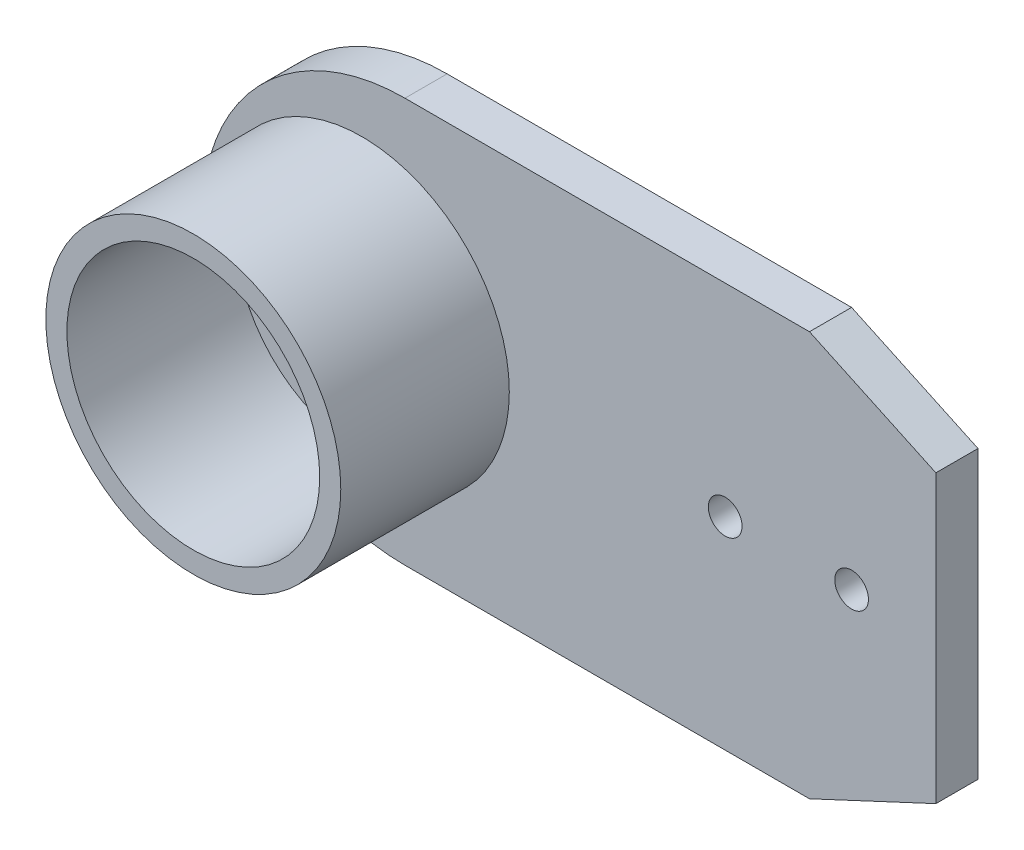
from build123d import *

# Parameters (mm, degrees)
BOSS_EXTRUDE2_DEPTH = 5
SKETCH2_R           = 2
CUT_EXTRUDE1_DEPTH  = 50.932454376
SKETCH3_R           = 5
CUT_EXTRUDE2_DEPTH  = 5
CUT_EXTRUDE5_DEPTH  = 50.932454376
SKETCH10_R          = 17.5
BOSS_EXTRUDE5_DEPTH = 20
SKETCH11_R          = 15
CUT_EXTRUDE6_DEPTH  = 20


with BuildPart() as part:
    # Sketch1 → Boss-Extrude2 (new body)
    with BuildSketch(Plane.XY):
        with BuildLine():
            Line((-19.5, 24), (43.5, 24))
            Line((43.5, 24), (43.5, -24))
            Line((43.5, -24), (-19.5, -24))
            ThreePointArc((-19.5, -24), (-43.5, 0), (-19.5, 24))
        make_face()
    extrude(amount=BOSS_EXTRUDE2_DEPTH)

    # Sketch2 → Cut-Extrude1 (cut, through all)
    with BuildSketch(Plane.XY.offset(5)):
        with Locations((33.5, 0)):
            Circle(SKETCH2_R)
        with Locations((18.5, 0)):
            Circle(SKETCH2_R)
    extrude(amount=-CUT_EXTRUDE1_DEPTH, mode=Mode.SUBTRACT)

    # Sketch3 → Cut-Extrude2 (cut)
    with BuildSketch(Plane.XY.offset(5)):
        with Locations((-24.61729874, 0)):
            Circle(SKETCH3_R)
    extrude(amount=-CUT_EXTRUDE2_DEPTH, mode=Mode.SUBTRACT)

    # Sketch9 → Cut-Extrude5 (cut, through all)
    with BuildSketch(Plane.XY.offset(5)):
        Polygon((28.5, 24), (43.5, 17), (43.5, 24), align=None)
        Polygon((43.5, -17), (28.5, -24), (43.5, -24), align=None)
    extrude(amount=-CUT_EXTRUDE5_DEPTH, mode=Mode.SUBTRACT)

    # Sketch10 → Boss-Extrude5 (add)
    with BuildSketch(Plane.XY.offset(5)):
        with Locations((-24.61729874, 0)):
            Circle(SKETCH10_R)
    extrude(amount=BOSS_EXTRUDE5_DEPTH)

    # Sketch11 → Cut-Extrude6 (cut)
    with BuildSketch(Plane.XY.offset(25)):
        with Locations((-24.61729874, 0)):
            Circle(SKETCH11_R)
    extrude(amount=-CUT_EXTRUDE6_DEPTH, mode=Mode.SUBTRACT)


solid = part.part
